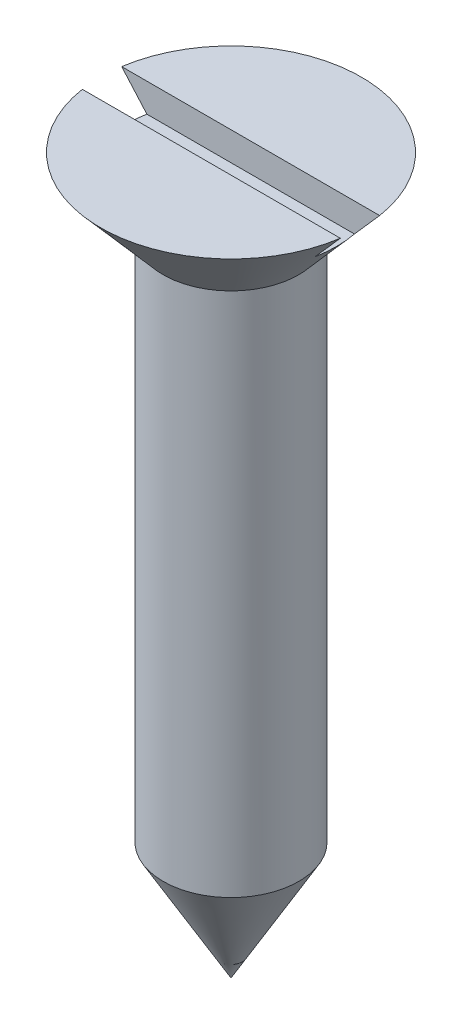
from build123d import *

# Parameters (mm, degrees)
SKETCH2_R           = 2.413
BOSS_EXTRUDE2_DEPTH = 25.4
SKETCH5_W           = 11.811
SKETCH5_H           = 1.397
CUT_EXTRUDE1_DEPTH  = 1.016


with BuildPart() as part:
    # Sketch2 → Boss-Extrude2 (new body)
    with BuildSketch(Plane(origin=(0, 0, 0), x_dir=(1, 0, 0), z_dir=(0, 1, 0))):
        with Locations(Location((0, 0, 0), (0, 0, 270))):
            Circle(SKETCH2_R)
    extrude(amount=BOSS_EXTRUDE2_DEPTH)

    # Sketch3 → Revolve1 (revolve)
    with BuildSketch(Plane.XY, mode=Mode.PRIVATE) as revolve1_sk:
        Polygon((0, 25.4), (0, 20.067467248), (4.6355, 25.4), align=None)
    revolve(revolve1_sk.sketch.rotate(Axis((0, 20.067467248, 0), (0, 1, 0)), 180), axis=Axis((0, 20.067467248, 0), (0, 1, 0)))

    # Sketch4 → Cut-Revolve1 (revolve, cut)
    with BuildSketch(Plane(origin=(0, 0, 0), x_dir=(0, 0, -1), z_dir=(1, 0, 0)), mode=Mode.PRIVATE) as cut_revolve1_sk:
        Polygon((0, -0.635), (0, 0), (2.413, 4.179438599), (2.413, -0.635), align=None)
    revolve(cut_revolve1_sk.sketch.rotate(Axis((0, 2.71415564, 0), (0, -1, 0)), 270), axis=Axis((0, 2.71415564, 0), (0, -1, 0)), mode=Mode.SUBTRACT)

    # Sketch5 → Cut-Extrude1 (cut)
    with BuildSketch(Plane(origin=(0, 25.4, 0), x_dir=(1, 0, 0), z_dir=(0, 1, 0))):
        Rectangle(SKETCH5_W, SKETCH5_H)
    extrude(amount=-CUT_EXTRUDE1_DEPTH, mode=Mode.SUBTRACT)


solid = part.part
